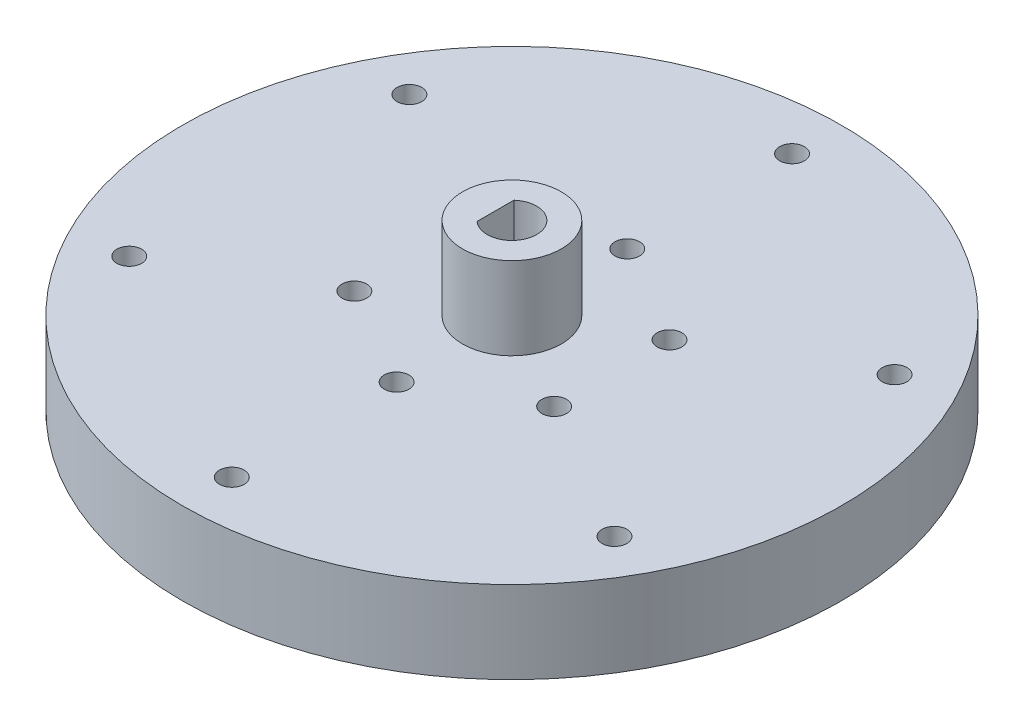
from build123d import *

# Parameters (mm, degrees)
SKETCH_1_R               = 20
EXTRUDE_1_DEPTH          = 5
SKETCH_1_7_R             = 3
EXTRUDE_2_DEPTH          = 10
SKETCH_2_R               = 0.75
CUT_EXTRUDE_1_DEPTH      = 31
PATTERN_CIRCULAR_1_COUNT = 6


with BuildPart() as part:
    # 草图1 → 凸台-拉伸1 (new body)
    with BuildSketch(Plane(origin=(0, 0, 0), x_dir=(1, 0, 0), z_dir=(0, 1, 0))):
        Circle(SKETCH_1_R)
    extrude(amount=EXTRUDE_1_DEPTH)

    # 草图1<7> → 凸台-拉伸2 (add)
    with BuildSketch(Plane(origin=(0, 0, 0), x_dir=(1, 0, 0), z_dir=(0, 1, 0))):
        Circle(SKETCH_1_7_R)
        with BuildLine():
            Line((-1, -1.118033989), (-1, 1.118033989))
            ThreePointArc((-1, 1.118033989), (1.5, 0), (-1, -1.118033989))
        make_face(mode=Mode.SUBTRACT)
    extrude(amount=EXTRUDE_2_DEPTH)

    # 草图2 → 切除-拉伸1 (cut, through all)
    with BuildSketch(Plane.XZ):
        with Locations((0, -7)):
            Circle(SKETCH_2_R)
        with Locations((0, -17)):
            Circle(SKETCH_2_R)
    cut_extrude_1 = extrude(amount=-CUT_EXTRUDE_1_DEPTH, mode=Mode.SUBTRACT)

    # 阵列(圆周)1: 切除-拉伸1 ×6 about axis
    pattern_circular_1_axis = Axis((0, 5, 0), (0, -1, 0))
    for i in range(1, PATTERN_CIRCULAR_1_COUNT):
        add(cut_extrude_1.rotate(pattern_circular_1_axis, i * 360 / PATTERN_CIRCULAR_1_COUNT), mode=Mode.SUBTRACT)


solid = part.part
